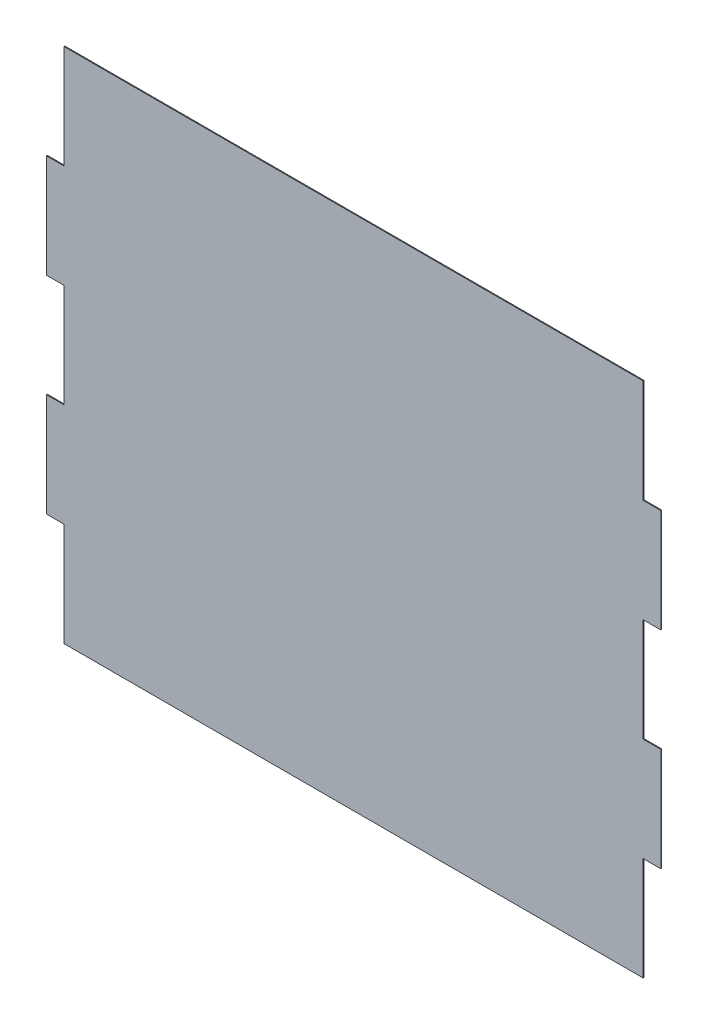
from build123d import *

# Parameters (mm, degrees)
BOSS_EXTRUDE1_DEPTH = 0.125


with BuildPart() as part:
    # Sketch1 → Boss-Extrude1 (new, symmetric)
    with BuildSketch(Plane.XY):
        Polygon((-84, 45), (-89.123944273, 45), (-89.123944273, 15), (-84, 15), (-84, -15), (-89.123944273, -15), (-89.123944273, -45), (-84, -45), (-84, -75), (84, -75), (84, -45), (89.123944273, -45), (89.123944273, -15), (84, -15), (84, 15), (89.123944273, 15), (89.123944273, 45), (84, 45), (84, 75), (-84, 75), align=None)
    extrude(amount=BOSS_EXTRUDE1_DEPTH, both=True)


solid = part.part
